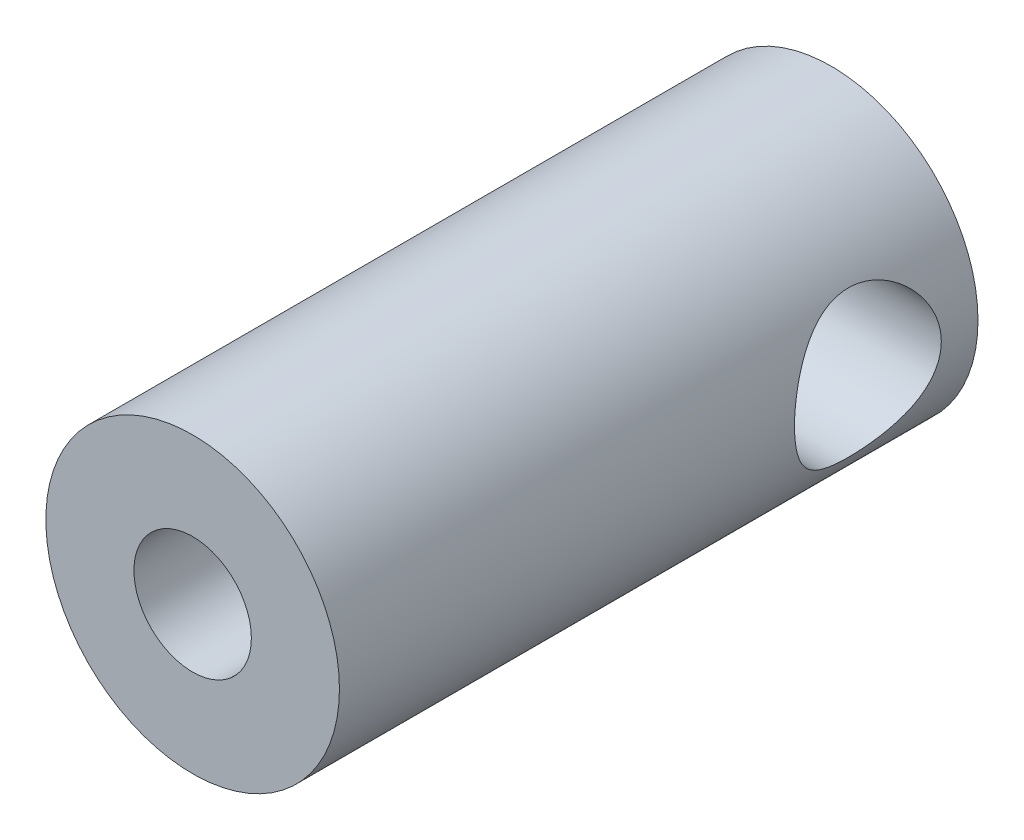
from build123d import *

# Parameters (mm, degrees)
SKETCH1_R               = 6.35
BOSS_EXTRUDE1_DEPTH     = 27.6225
CUT_EXTRUDE2_DEPTH      = 30.045610791
CUT_EXTRUDE2_DEPTH_BACK = 30.045610791
SKETCH3_R               = 3.175
SKETCH2_2_R             = 2.54
CUT_EXTRUDE3_DEPTH      = 12.7


with BuildPart() as part:
    # Sketch1 → Boss-Extrude1 (new body)
    with BuildSketch(Plane.XY):
        Circle(SKETCH1_R)
    extrude(amount=BOSS_EXTRUDE1_DEPTH)

    # Sketch3 → Cut-Extrude2 (cut, two sides: drawn at the far end of the back side and taken through both)
    with BuildSketch(Plane(origin=(0, 0, 0), x_dir=(0, 0, -1), z_dir=(1, 0, 0)).offset(-CUT_EXTRUDE2_DEPTH_BACK)):
        with Locations((-4.7625, 0)):
            Circle(SKETCH3_R)
    extrude(amount=CUT_EXTRUDE2_DEPTH + CUT_EXTRUDE2_DEPTH_BACK, mode=Mode.SUBTRACT)

    # Sketch2<2> → Cut-Extrude3 (cut)
    with BuildSketch(Plane.XY.offset(27.6225)):
        Circle(SKETCH2_2_R)
    extrude(amount=-CUT_EXTRUDE3_DEPTH, mode=Mode.SUBTRACT)


solid = part.part
